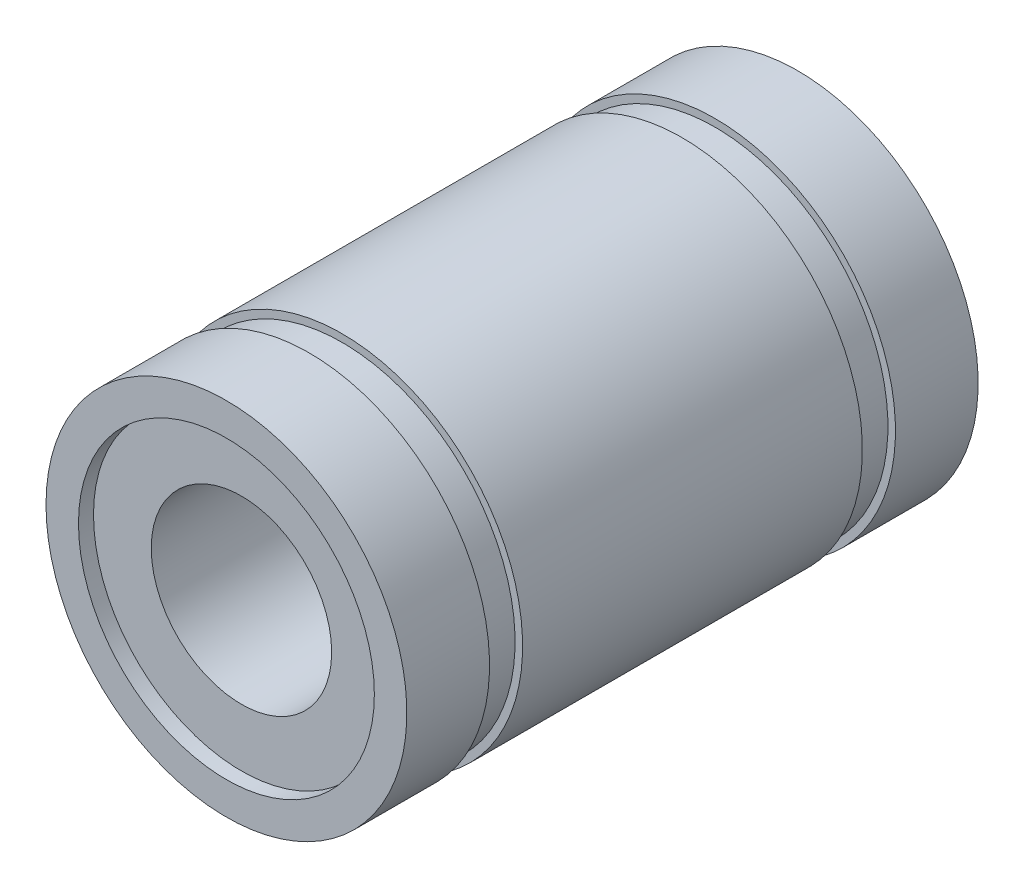
from build123d import *


with BuildPart() as part:
    # Sketch1 → Revolve1 (revolve)
    with BuildSketch(Plane.XZ, mode=Mode.PRIVATE) as revolve1_sk:
        Polygon((6, 16.25), (6, 19), (4.92, 19), (4.92, 18.5), (3, 18.5), (3, 0.5), (4.92, 0.5), (4.92, 0), (6, 0), (6, 2.75), (5.75, 2.75), (5.75, 3.85), (6, 3.85), (6, 15.15), (5.75, 15.15), (5.75, 16.25), align=None)
    revolve(revolve1_sk.sketch.rotate(Axis((0, 0, 19), (0, 0, -1)), 180), axis=Axis((0, 0, 19), (0, 0, -1)))


solid = part.part
